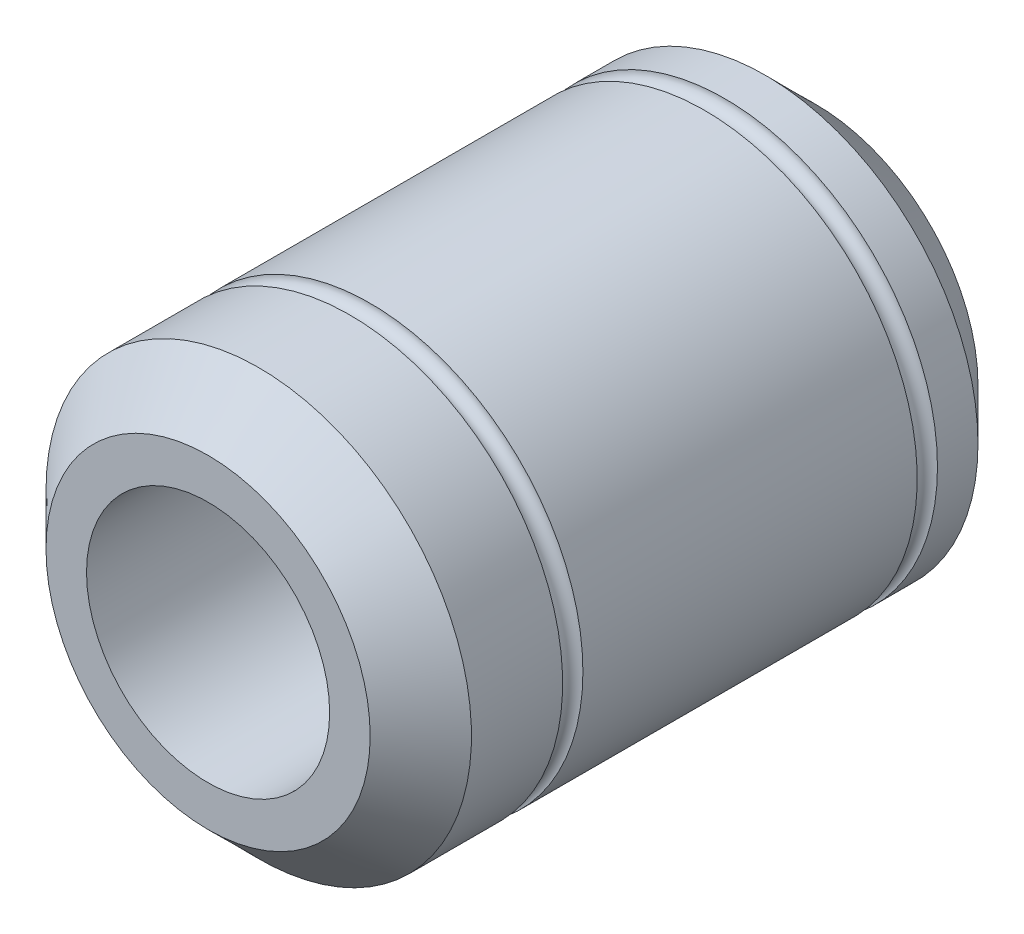
from build123d import *

# Parameters (mm, degrees)
SKETCH_1_R      = 10.5
SKETCH_1_R_2    = 6
EXTRUDE_1_DEPTH = 30
SKETCH_4_R      = 0.5


with BuildPart() as part:
    # 草图1 → 凸台-拉伸1 (new body)
    with BuildSketch(Plane.XY):
        Circle(SKETCH_1_R)
        Circle(SKETCH_1_R_2, mode=Mode.SUBTRACT)
    extrude(amount=-EXTRUDE_1_DEPTH)

    # 草图2 → 切除-旋转3 (revolve, cut)
    with BuildSketch(Plane(origin=(0, 0, 0), x_dir=(1, 0, 0), z_dir=(0, 1, 0)), mode=Mode.PRIVATE) as cut_revolve_3_sk:
        Polygon((7.5, 30.5), (11, 27), (11, 30.5), align=None)
        Polygon((11, 3), (7.5, -0.5), (11, -0.5), align=None)
    revolve(cut_revolve_3_sk.sketch.rotate(Axis((0, 0, -40.551392487), (0, 0, 1)), 180), axis=Axis((0, 0, -40.551392487), (0, 0, 1)), mode=Mode.SUBTRACT)

    # 草图4 → 切除-旋转4 (revolve, cut)
    with BuildSketch(Plane(origin=(0, 0, 0), x_dir=(1, 0, 0), z_dir=(0, 1, 0)), mode=Mode.PRIVATE) as cut_revolve_4_sk:
        with Locations((10.5, 25)):
            Circle(SKETCH_4_R)
        with Locations((10.5, 7.5)):
            Circle(SKETCH_4_R)
    revolve(cut_revolve_4_sk.sketch.rotate(Axis((0, 0, -36.832356515), (0, 0, 1)), 180), axis=Axis((0, 0, -36.832356515), (0, 0, 1)), mode=Mode.SUBTRACT)


solid = part.part
